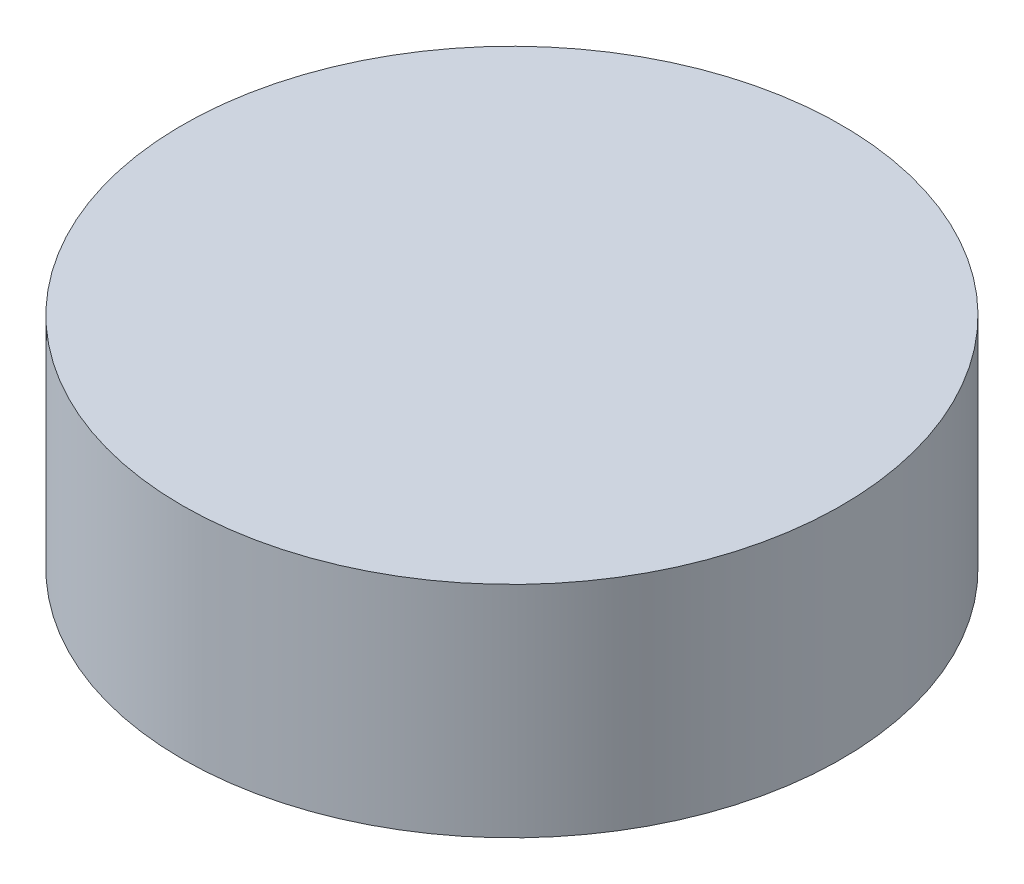
from build123d import *

# Parameters (mm, degrees)
SKETCH2_R           = 5
BOSS_EXTRUDE1_DEPTH = 3.33
SKETCH5_R           = 3.5
CUT_EXTRUDE1_DEPTH  = 2


with BuildPart() as part:
    # Sketch2 → Boss-Extrude1 (new body)
    with BuildSketch(Plane(origin=(0, 0, 0), x_dir=(1, 0, 0), z_dir=(0, 1, 0))):
        with Locations(Location((0, 0, 0), (0, 0, 270))):
            Circle(SKETCH2_R)
    extrude(amount=BOSS_EXTRUDE1_DEPTH)

    # Sketch5 → Cut-Extrude1 (cut)
    with BuildSketch(Plane.XZ):
        with Locations(Location((0, 0, 0), (0, 0, 270))):
            Circle(SKETCH5_R)
    extrude(amount=-CUT_EXTRUDE1_DEPTH, mode=Mode.SUBTRACT)


solid = part.part
